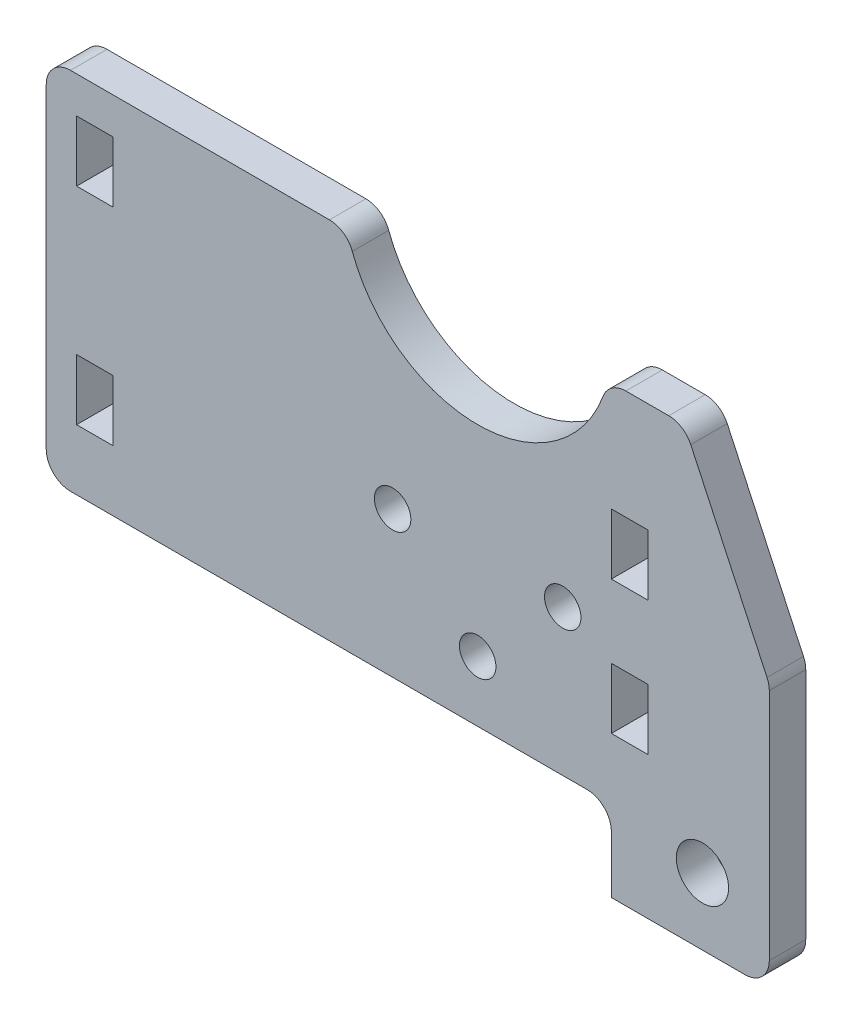
from build123d import *

# Parameters (mm, degrees)
SKETCH_1_W          = 52
SKETCH_1_H          = 30
EXTRUDE_1_DEPTH     = 3
SKETCH_2_W          = 3
SKETCH_2_H          = 5
CUT_EXTRUDE_1_DEPTH = 4
SKETCH_6_W          = 4.623864405
SKETCH_6_H          = 6.377744006
EXTRUDE_2_DEPTH     = 3
SKETCH_7_W          = 3
SKETCH_7_H          = 5
CUT_EXTRUDE_4_DEPTH = 10
SKETCH_9_R          = 2
EXTRUDE_3_DEPTH     = 3
SKETCH_10_R         = 2.25
CUT_EXTRUDE_5_DEPTH = 10
SKETCH_11_R         = 1.5
CUT_EXTRUDE_6_DEPTH = 10
SKETCH_12_R         = 11
CUT_EXTRUDE_7_DEPTH = 10
FILLET_1_R          = 2
SKETCH_13_W         = 2
SKETCH_13_H         = 36.695
EXTRUDE_4_DEPTH     = 3
FILLET_2_R          = 2
CHAMFER_1_SIZE      = 7
CHAMFER_1_SIZE2     = 15.011548444
FILLET_3_R          = 2
SKETCH_15_R         = 2.25
SKETCH_15_R_2       = 2.15
EXTRUDE_6_DEPTH     = 3
FILLET_4_R          = 2


with BuildPart() as part:
    # 草图1 → 凸台-拉伸1 (new body)
    with BuildSketch(Plane.XY):
        Rectangle(SKETCH_1_W, SKETCH_1_H)
    extrude(amount=EXTRUDE_1_DEPTH)

    # 草图2 → 切除-拉伸1 (cut)
    with BuildSketch(Plane.XY.offset(3)):
        with Locations((22, -7.5)):
            Rectangle(SKETCH_2_W, SKETCH_2_H)
        with Locations((22, 9.5)):
            Rectangle(SKETCH_2_W, SKETCH_2_H)
        with Locations((-22, 9.5)):
            Rectangle(SKETCH_2_W, SKETCH_2_H)
        with Locations((-22, -7.5)):
            Rectangle(SKETCH_2_W, SKETCH_2_H)
    extrude(amount=-CUT_EXTRUDE_1_DEPTH, mode=Mode.SUBTRACT)

    # 草图6 → 凸台-拉伸2 (add)
    with BuildSketch(Plane(origin=(0, 0, 0), x_dir=(-1, 0, 0), z_dir=(0, 0, -1))):
        with Locations((-21.865764725, 9.519388139)):
            Rectangle(SKETCH_6_W, SKETCH_6_H)
    extrude(amount=-EXTRUDE_2_DEPTH)

    # 草图7 → 切除-拉伸4 (cut)
    with BuildSketch(Plane(origin=(0, 0, 0), x_dir=(-1, 0, 0), z_dir=(0, 0, -1))):
        with Locations((-22, 3.5)):
            Rectangle(SKETCH_7_W, SKETCH_7_H)
    extrude(amount=-CUT_EXTRUDE_4_DEPTH, mode=Mode.SUBTRACT)

    # 草图9 → 凸台-拉伸3 (add)
    with BuildSketch(Plane.XY.offset(3)):
        Polygon((26, 15), (31.495, 15), (31.495, -21.695), (20.5, -21.695), (20.5, -15), (26, -15), align=None)
        with Locations((27.995, -16.195)):
            Circle(SKETCH_9_R, mode=Mode.SUBTRACT)
    extrude(amount=-EXTRUDE_3_DEPTH)

    # 草图10 → 切除-拉伸5 (cut)
    with BuildSketch(Plane.XY.offset(3)):
        with Locations((27.995, -16.195)):
            Circle(SKETCH_10_R)
    extrude(amount=-CUT_EXTRUDE_5_DEPTH, mode=Mode.SUBTRACT)

    # 草图11 → 切除-拉伸6 (cut)
    with BuildSketch(Plane.XY.offset(3)):
        with Locations((2.5, -3)):
            Circle(SKETCH_11_R)
        with Locations((16.5, -3)):
            Circle(SKETCH_11_R)
        with Locations((9.5, -10)):
            Circle(SKETCH_11_R)
    extrude(amount=-CUT_EXTRUDE_6_DEPTH, mode=Mode.SUBTRACT)

    # 草图12 → 切除-拉伸7 (cut)
    with BuildSketch(Plane.XY.offset(3)):
        with Locations((9.5, 17.5)):
            Circle(SKETCH_12_R)
    extrude(amount=-CUT_EXTRUDE_7_DEPTH, mode=Mode.SUBTRACT)

    # 圆角1
    fillet_1_edges = [part.edges().sort_by_distance(p)[0] for p in [
        (20.5, -15, 1.5),
        (20.212142643, 15, 1.5),
        (-1.212142643, 15, 1.5),
    ]]
    fillet(fillet_1_edges, radius=FILLET_1_R)

    # 草图13 → 凸台-拉伸4 (add)
    with BuildSketch(Plane.XY.offset(3)):
        with Locations((32.495, -3.3475)):
            Rectangle(SKETCH_13_W, SKETCH_13_H)
    extrude(amount=-EXTRUDE_4_DEPTH)

    # 圆角2
    fillet_2_edges = [part.edges().sort_by_distance(p)[0] for p in [
        (33.495, -21.695, 1.5),
    ]]
    fillet(fillet_2_edges, radius=FILLET_2_R)

    # 倒角1
    chamfer_1_edges = [part.edges().sort_by_distance(p)[0] for p in [
        (33.495, 15, 1.5),
    ]]
    chamfer_1_side = [part.faces().sort_by_distance(p)[0] for p in [
        (27.595655459, 15, 1.5),
    ]]
    chamfer(chamfer_1_edges, length=CHAMFER_1_SIZE, length2=CHAMFER_1_SIZE2, reference=chamfer_1_side[0])

    # 圆角3
    fillet_3_edges = [part.edges().sort_by_distance(p)[0] for p in [
        (33.495, -0.011548444, 1.5),
        (26.495, 15, 1.5),
    ]]
    fillet(fillet_3_edges, radius=FILLET_3_R)

    # 草图15 → 凸台-拉伸6 (add)
    with BuildSketch(Plane.XY.offset(3)):
        with Locations((27.995, -16.195)):
            Circle(SKETCH_15_R)
        with Locations((27.995, -16.195)):
            Circle(SKETCH_15_R_2, mode=Mode.SUBTRACT)
    extrude(amount=-EXTRUDE_6_DEPTH)

    # 圆角4
    fillet_4_edges = [part.edges().sort_by_distance(p)[0] for p in [
        (-26, -15, 1.5),
        (-26, 15, 1.5),
    ]]
    fillet(fillet_4_edges, radius=FILLET_4_R)


solid = part.part
